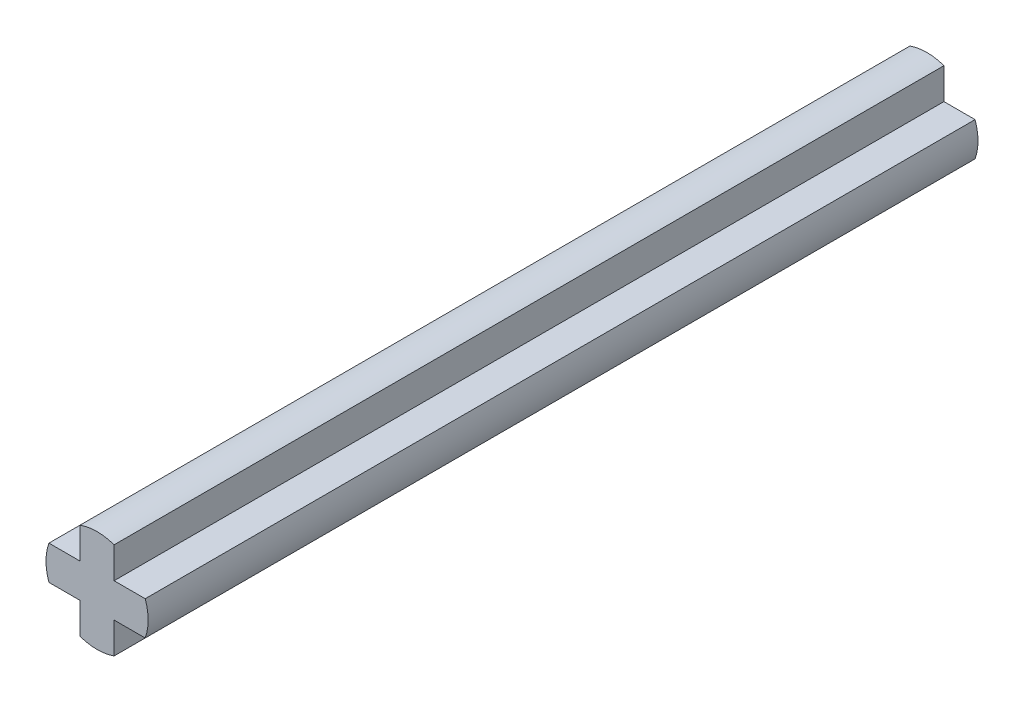
from build123d import *

# Parameters (mm, degrees)
BOSS_EXTRU_1_DEPTH = 39


with BuildPart() as part:
    # Esquisse1 → Boss.-Extru.1 (new body)
    with BuildSketch(Plane.XY):
        with BuildLine():
            Line((0.8, 0.8), (2.2627417, 0.8))
            ThreePointArc((2.2627417, 0.8), (2.4, 0), (2.2627417, -0.8))
            Line((2.2627417, -0.8), (0.8, -0.8))
            Line((0.8, -0.8), (0.8, -2.2627417))
            ThreePointArc((0.8, -2.2627417), (0, -2.4), (-0.8, -2.2627417))
            Line((-0.8, -2.2627417), (-0.8, -0.8))
            Line((-0.8, -0.8), (-2.2627417, -0.8))
            ThreePointArc((-2.2627417, -0.8), (-2.4, 0), (-2.2627417, 0.8))
            Line((-2.2627417, 0.8), (-0.8, 0.8))
            Line((-0.8, 0.8), (-0.8, 2.2627417))
            ThreePointArc((-0.8, 2.2627417), (0, 2.4), (0.8, 2.2627417))
            Line((0.8, 2.2627417), (0.8, 0.8))
        make_face()
    extrude(amount=BOSS_EXTRU_1_DEPTH)


solid = part.part
